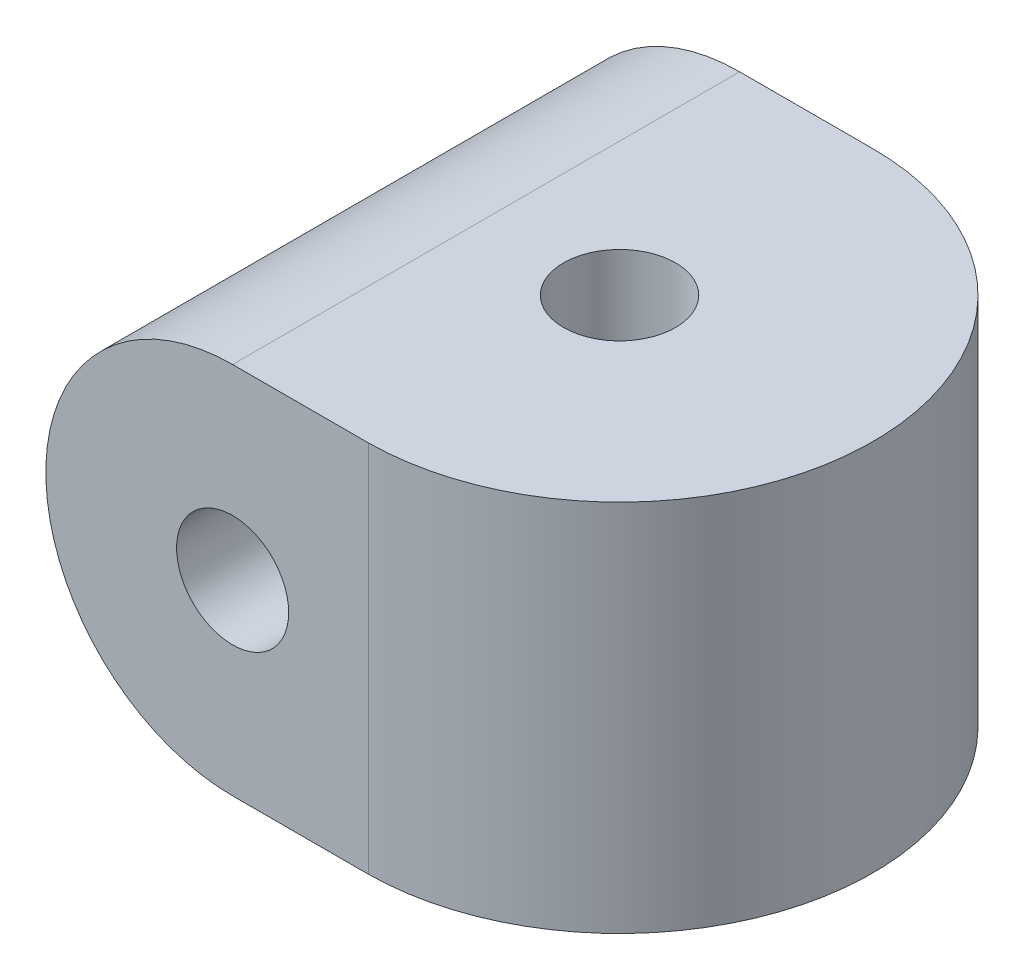
from build123d import *

# Parameters (mm, degrees)
CROQUIS1_R              = 2.1
SALIENTE_EXTRUIR1_DEPTH = 7
CROQUIS2_R              = 2.1
CORTAR_EXTRUIR1_DEPTH   = 26.198920843
CORTAR_EXTRUIR2_DEPTH   = 26.198920843


with BuildPart() as part:
    # Croquis1 → Saliente-Extruir1 (new, symmetric)
    with BuildSketch(Plane(origin=(0, 0, 0), x_dir=(1, 0, 0), z_dir=(0, 1, 0))):
        with BuildLine():
            Line((0, 9.5), (-15, 9.5))
            Line((-15, 9.5), (-15, -9.499621356))
            Line((-15, -9.499621356), (0.084818048, -9.499621356))
            ThreePointArc((0.084818048, -9.499621356), (9.499905338, 0.042409446), (0, 9.5))
        make_face()
        with Locations(Location((0, 0, 0), (0, 0, 270))):
            Circle(CROQUIS1_R, mode=Mode.SUBTRACT)
    extrude(amount=SALIENTE_EXTRUIR1_DEPTH, both=True)

    # Croquis2 → Cortar-Extruir1 (cut, through all)
    with BuildSketch(Plane.XY.offset(9.499621356)):
        with Locations((-5, 0)):
            Circle(CROQUIS2_R)
    extrude(amount=-CORTAR_EXTRUIR1_DEPTH, mode=Mode.SUBTRACT)

    # Croquis3 → Cortar-Extruir2 (cut, through all)
    with BuildSketch(Plane.XY.offset(9.499621356)):
        with BuildLine():
            Line((-5, 7), (-15, 7))
            Line((-15, 7), (-15, -7))
            Line((-15, -7), (-5, -7))
            ThreePointArc((-5, -7), (-12, 0), (-5, 7))
        make_face()
    extrude(amount=-CORTAR_EXTRUIR2_DEPTH, mode=Mode.SUBTRACT)


solid = part.part
